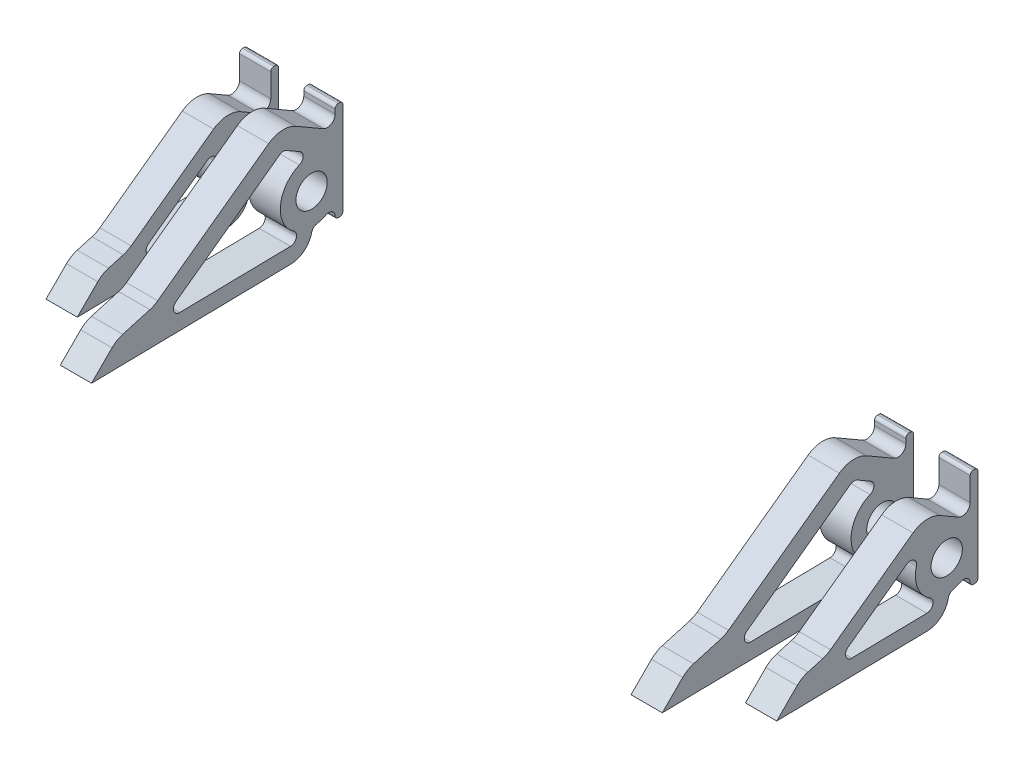
from build123d import *

# Parameters (mm, degrees)
SKETCH1_R           = 3.175
BOSS_EXTRUDE1_DEPTH = 3.175
SKETCH5_R           = 3.175
BOSS_EXTRUDE3_DEPTH = 3.175
FILLET1_R           = 5.08
FILLET4_R           = 5.08
CUT_EXTRUDE1_DEPTH  = 6.35
CUT_EXTRUDE2_DEPTH  = 6.35
BOSS_EXTRUDE2_DEPTH = 6.35
BOSS_EXTRUDE4_DEPTH = 6.35
FILLET2_R           = 1.5875
FILLET3_R           = 0.635
FILLET5_R           = 1.5875
FILLET6_R           = 0.635


with BuildPart() as part:
    # Sketch1 → Boss-Extrude1 (new, symmetric)
    with BuildSketch(Plane(origin=(57.892249952, 0, 0), x_dir=(0, 0, -1), z_dir=(1, 0, 0))):
        Polygon((-231.855660614, -25.4), (-180.865221791, -24.50995858), (-180.865221791, -6.480028934), (-193.262453395, 0.67751607), (-219.155660614, -18.135000161), (-226.775660614, -20.32), align=None)
        with Locations((-187.215221791, -13.97)):
            Circle(SKETCH1_R, mode=Mode.SUBTRACT)
    extrude(amount=BOSS_EXTRUDE1_DEPTH, both=True)

    # Fillet1
    fillet1_edges = [part.edges().sort_by_distance(p)[0] for p in [
        (57.892249952, -20.32, 226.775660614),
        (57.892249952, -18.135000161, 219.155660614),
        (57.892249952, 0.67751607, 193.262453395),
    ]]
    fillet(fillet1_edges, radius=FILLET1_R)

    # Sketch3 → Cut-Extrude1 (cut)
    with BuildSketch(Plane(origin=(61.067249952, 0, 0), x_dir=(0, 0, -1), z_dir=(1, 0, 0))):
        with BuildLine():
            Line((-180.865221791, -24.50995858), (-180.865221791, -21.33495858))
            Line((-180.865221791, -21.33495858), (-182.452721791, -21.33495858))
            Line((-182.452721791, -21.33495858), (-182.452721791, -20.74250646))
            ThreePointArc((-182.452721791, -20.74250646), (-183.061792836, -19.658037504), (-184.304805124, -19.613755383))
            ThreePointArc((-184.304805124, -19.613755383), (-185.208946379, -19.994728954), (-186.16098311, -20.231875183))
            ThreePointArc((-186.16098311, -20.231875183), (-186.82506001, -20.563703164), (-187.190186006, -21.210070663))
            ThreePointArc((-187.190186006, -21.210070663), (-188.717018273, -23.691824965), (-191.452787273, -24.694765223))
            Line((-191.452787273, -24.694765223), (-180.865221791, -24.50995858))
        make_face()
        with BuildLine():
            ThreePointArc((-191.508198664, -21.52024879), (-190.314222123, -20.616366845), (-190.811172982, -19.203701848))
            ThreePointArc((-190.811172982, -19.203701848), (-193.533541609, -13.336490186), (-189.70051712, -8.126558623))
            ThreePointArc((-189.70051712, -8.126558623), (-188.929917526, -7.034951632), (-189.562576185, -5.858018084))
            Line((-189.562576185, -5.858018084), (-192.310443752, -4.271536005))
            ThreePointArc((-192.310443752, -4.271536005), (-193.011910416, -4.103128759), (-193.691931022, -4.343936685))
            Line((-193.691931022, -4.343936685), (-214.710148165, -19.614565302))
            ThreePointArc((-214.710148165, -19.614565302), (-215.168031937, -21.044993799), (-213.941496339, -21.911823458))
            Line((-213.941496339, -21.911823458), (-191.508198664, -21.52024879))
        make_face()
    extrude(amount=-CUT_EXTRUDE1_DEPTH, mode=Mode.SUBTRACT)

    # Sketch4 → Boss-Extrude2 (add)
    with BuildSketch(Plane(origin=(61.067249952, 0, 0), x_dir=(0, 0, -1), z_dir=(1, 0, 0))):
        Polygon((-180.865221791, -6.480028934), (-180.865221791, -1.27), (-182.452721791, -1.27), (-182.452721791, -5.563485381), align=None)
    extrude(amount=-BOSS_EXTRUDE2_DEPTH)

    # Fillet2
    fillet2_edges = [part.edges().sort_by_distance(p)[0] for p in [
        (57.892249952, -5.563485381, 182.452721791),
    ]]
    fillet(fillet2_edges, radius=FILLET2_R)

    # Fillet3
    fillet3_edges = [part.edges().sort_by_distance(p)[0] for p in [
        (57.892249952, -21.33495858, 182.452721791),
        (57.892249952, -21.33495858, 180.865221791),
        (57.892249952, -1.27, 180.865221791),
        (57.892249952, -1.27, 182.452721791),
    ]]
    fillet(fillet3_edges, radius=FILLET3_R)


with BuildPart() as body_2:
    # Sketch5 → Boss-Extrude3 (new, symmetric)
    with BuildSketch(Plane(origin=(70.941499952, 0, 0), x_dir=(0, 0, -1), z_dir=(1, 0, 0))):
        Polygon((-221.695660614, -25.4), (-180.865221791, -24.687302039), (-180.865221791, -10.303825791), (-191.379301288, -4.233519163), (-211.502377127, -18.853789554), (-216.615660614, -20.32), align=None)
        with Locations((-187.215221791, -13.97)):
            Circle(SKETCH5_R, mode=Mode.SUBTRACT)
    extrude(amount=BOSS_EXTRUDE3_DEPTH, both=True)

    # Fillet4
    fillet4_edges = [body_2.edges().sort_by_distance(p)[0] for p in [
        (70.941499952, -20.32, 216.615660614),
        (70.941499952, -18.853789554, 211.502377127),
        (70.941499952, -4.233519163, 191.379301288),
    ]]
    fillet(fillet4_edges, radius=FILLET4_R)

    # Sketch6 → Cut-Extrude2 (cut)
    with BuildSketch(Plane(origin=(74.116499952, 0, 0), x_dir=(0, 0, -1), z_dir=(1, 0, 0))):
        with BuildLine():
            ThreePointArc((-193.363030266, -12.380361377), (-193.877853131, -11.012648719), (-195.339079232, -11.034982069))
            Line((-195.339079232, -11.034982069), (-207.21180843, -19.661024755))
            ThreePointArc((-207.21180843, -19.661024755), (-207.669692202, -21.091453251), (-206.443156603, -21.958282911))
            Line((-206.443156603, -21.958282911), (-191.245297611, -21.693003295))
            ThreePointArc((-191.245297611, -21.693003295), (-190.044026849, -20.763940061), (-190.592088771, -19.347663935))
            ThreePointArc((-190.592088771, -19.347663935), (-193.115703709, -16.316659995), (-193.363030266, -12.380361377))
        make_face()
        with BuildLine():
            ThreePointArc((-182.452721791, -20.74250646), (-183.061792836, -19.658037504), (-184.304805124, -19.613755383))
            ThreePointArc((-184.304805124, -19.613755383), (-185.084866405, -19.951980101), (-185.903120157, -20.182961395))
            ThreePointArc((-185.903120157, -20.182961395), (-186.552906668, -20.541936854), (-186.891015879, -21.202821149))
            ThreePointArc((-186.891015879, -21.202821149), (-186.933456055, -21.411876336), (-186.985876446, -21.618654822))
            ThreePointArc((-186.985876446, -21.618654822), (-188.527147644, -23.923449952), (-191.13447483, -24.866552518))
            Line((-191.13447483, -24.866552518), (-180.865221791, -24.687302039))
            Line((-180.865221791, -24.687302039), (-180.865221791, -21.33495858))
            Line((-180.865221791, -21.33495858), (-182.452721791, -21.33495858))
            Line((-182.452721791, -21.33495858), (-182.452721791, -20.74250646))
        make_face()
    extrude(amount=-CUT_EXTRUDE2_DEPTH, mode=Mode.SUBTRACT)

    # Sketch7 → Boss-Extrude4 (add)
    with BuildSketch(Plane(origin=(74.116499952, 0, 0), x_dir=(0, 0, -1), z_dir=(1, 0, 0))):
        Polygon((-180.865221791, -10.303825791), (-180.865221791, -1.27), (-182.452721791, -1.27), (-182.452721791, -9.387282238), align=None)
    extrude(amount=-BOSS_EXTRUDE4_DEPTH)

    # Fillet5
    fillet5_edges = [body_2.edges().sort_by_distance(p)[0] for p in [
        (70.941499952, -9.387282238, 182.452721791),
    ]]
    fillet(fillet5_edges, radius=FILLET5_R)

    # Fillet6
    fillet6_edges = [body_2.edges().sort_by_distance(p)[0] for p in [
        (70.941499952, -1.27, 180.865221791),
        (70.941499952, -1.27, 182.452721791),
        (70.941499952, -21.33495858, 180.865221791),
        (70.941499952, -21.33495858, 182.452721791),
    ]]
    fillet(fillet6_edges, radius=FILLET6_R)


with BuildPart() as body_3:
    # Mirror1: mirrored copy
    add(part.part.mirror(Plane(origin=(0, 0, 0), x_dir=(0, 0, 1), z_dir=(1, 0, 0))))


with BuildPart() as body_4:
    # Mirror1 2: mirrored copy
    add(body_2.part.mirror(Plane(origin=(0, 0, 0), x_dir=(0, 0, 1), z_dir=(1, 0, 0))))


solid = Compound([part.part, body_2.part, body_3.part, body_4.part])
